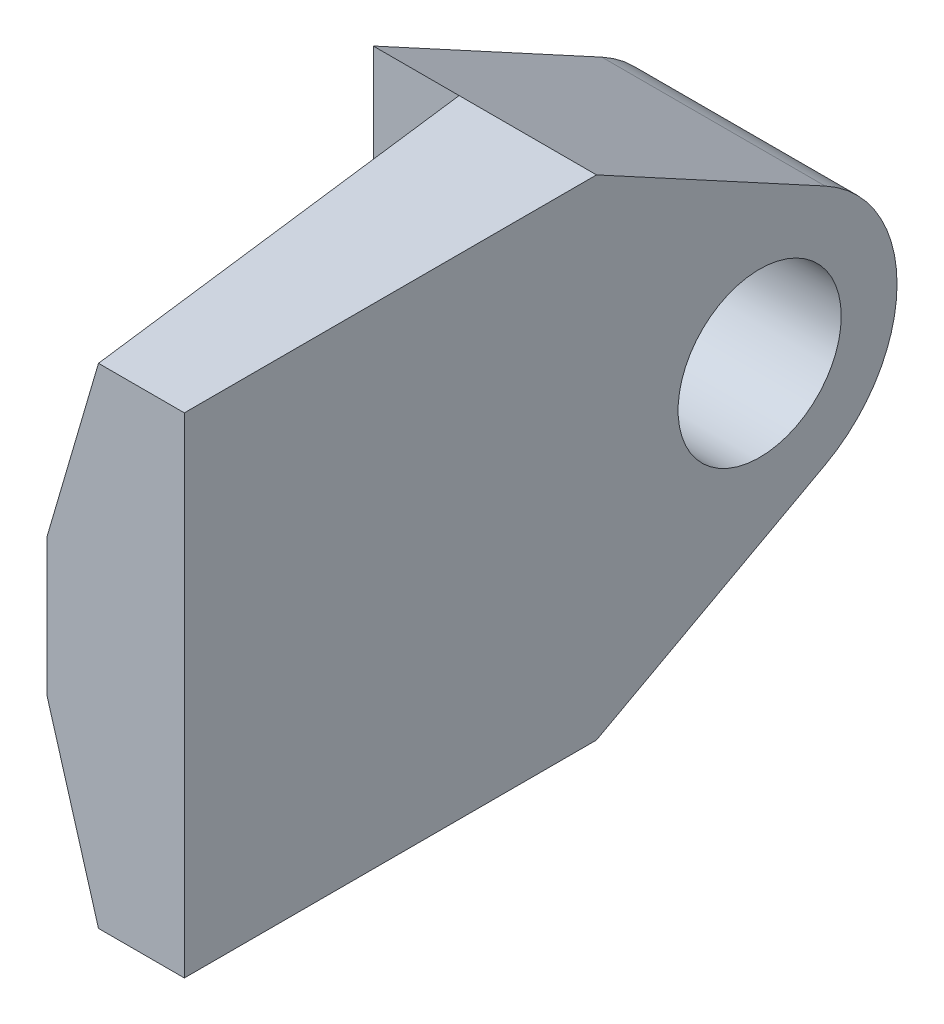
from build123d import *

# Parameters (mm, degrees)
SKETCH1_W           = 32
SKETCH1_H           = 114
BOSS_EXTRUDE1_DEPTH = 96
CUT_EXTRUDE1_REACH  = 157.637
CUT_EXTRUDE2_REACH  = 152.756
SKETCH8_R           = 19
BOSS_EXTRUDE2_DEPTH = 52


with BuildPart() as part:
    # Sketch1 → Boss-Extrude1 (new body)
    with BuildSketch(Plane.XY):
        with Locations((-16, 57)):
            Rectangle(SKETCH1_W, SKETCH1_H)
    extrude(amount=-BOSS_EXTRUDE1_DEPTH)

    # Sketch4 → Cut-Extrude1 (cut, up to next)
    with BuildSketch(Plane(origin=(-18.160548949, -5.315282619, 2.270068619), x_dir=(0.11431729078371765, 0.033458719253771, 0.9928806933029609), z_dir=(-0.9529047420591578, -0.27889894889536315, 0.11911309275739475)), mode=Mode.PRIVATE) as cut_extrude1_sk1:
        Polygon((-98.974699862, 8.988760105), (-2.286345816, 48.337993792), (-2.286345816, 5.617975065), align=None)
    cut_extrude1_tool1 = extrude(cut_extrude1_sk1.sketch, amount=CUT_EXTRUDE1_REACH, mode=Mode.PRIVATE) & part.part
    add(cut_extrude1_tool1.solids().sort_by_distance((-28, 13.666667, -32))[0], mode=Mode.SUBTRACT)

    # Sketch3 → Cut-Extrude2 (cut, up to next)
    with BuildSketch(Plane(origin=(-48.457659878, 14.18272972, 6.057207485), x_dir=(0.11431729078371765, -0.033458719253771, 0.9928806933029609), z_dir=(-0.9529047420591578, 0.27889894889536315, 0.11911309275739475)), mode=Mode.PRIVATE) as cut_extrude2_sk1:
        Polygon((-6.100639811, 61.072070607), (-6.100639811, 103.792089334), (-102.788993857, 100.421304294), align=None)
    cut_extrude2_tool1 = extrude(cut_extrude2_sk1.sketch, amount=CUT_EXTRUDE2_REACH, mode=Mode.PRIVATE) & part.part
    add(cut_extrude2_tool1.solids().sort_by_distance((-28, 100.333333, -32))[0], mode=Mode.SUBTRACT)

    # Sketch8 → Boss-Extrude2 (add)
    with BuildSketch(Plane(origin=(0, 0, 0), x_dir=(0, 0, -1), z_dir=(1, 0, 0))):
        with BuildLine():
            Line((96, 114), (149.250761153, 85.132086383))
            ThreePointArc((149.250761153, 85.132086383), (166, 57), (149.250761153, 28.867913617))
            Line((149.250761153, 28.867913617), (96, 0))
            Line((96, 0), (96, 114))
        make_face()
        with Locations((134, 57)):
            Circle(SKETCH8_R, mode=Mode.SUBTRACT)
    extrude(amount=-BOSS_EXTRUDE2_DEPTH)


solid = part.part
